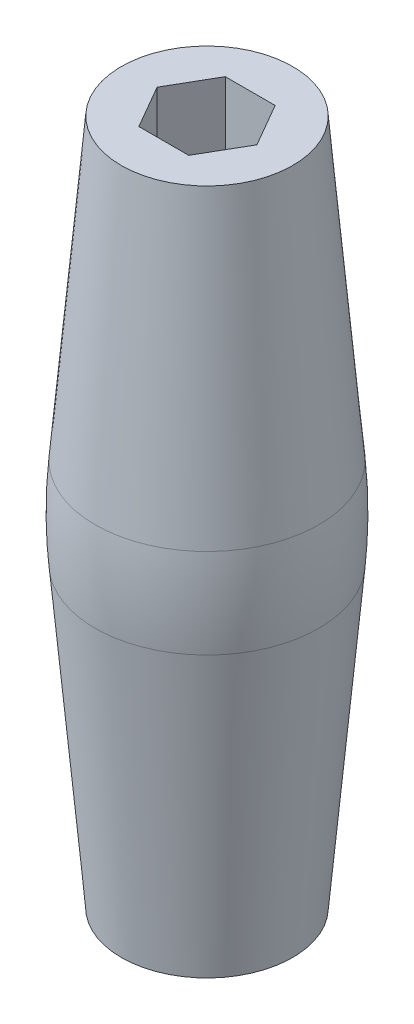
from build123d import *

# Parameters (mm, degrees)
SKETCH1_R           = 12.7
BOSS_EXTRUDE1_DEPTH = 101.6
SKETCH2_R           = 12.7
BOSS_EXTRUDE2_DEPTH = 50.8
BOSS_EXTRUDE2_DRAFT = 5
SKETCH3_R           = 12.7
BOSS_EXTRUDE3_DEPTH = 50.8
BOSS_EXTRUDE3_DRAFT = 5
CUT_EXTRUDE1_DEPTH  = 105.452968153
FILLET2_R           = 76.2


with BuildPart() as part:
    # Sketch1 → Boss-Extrude1 (new body)
    with BuildSketch(Plane(origin=(0, 0, 0), x_dir=(1, 0, 0), z_dir=(0, 1, 0))):
        with Locations(Location((0, 0, 0), (0, 0, 270))):
            Circle(SKETCH1_R)
    extrude(amount=BOSS_EXTRUDE1_DEPTH)


with BuildPart() as boss_extrude2_tool:
    # Sketch2 → Boss-Extrude2 (with draft: the straight prism first)
    with BuildSketch(Plane(origin=(0, 101.6, 0), x_dir=(1, 0, 0), z_dir=(0, 1, 0))):
        with Locations(Location((0, 0, 0), (0, 0, 270))):
            Circle(SKETCH2_R)
    extrude(amount=-BOSS_EXTRUDE2_DEPTH)
    # Boss-Extrude2: the draft: its side faces are tilted about the plane it starts from
    boss_extrude2_sides = [boss_extrude2_tool.faces().sort_by_distance(p)[0] for p in [
        (0, 76.2, -12.7),
    ]]
    draft(boss_extrude2_sides, Plane(origin=(0, 101.6, 0), x_dir=(1, 0, 0), z_dir=(0, 1, 0)), BOSS_EXTRUDE2_DRAFT)


with BuildPart() as part_1:
    add(part.part)

    # Boss-Extrude2: add boss_extrude2_tool
    add(boss_extrude2_tool.part)


with BuildPart() as boss_extrude3_tool:
    # Sketch3 → Boss-Extrude3 (with draft: the straight prism first)
    with BuildSketch(Plane(origin=(0, 0, 0), x_dir=(-1, 0, 0), z_dir=(0, -1, 0))):
        Circle(SKETCH3_R)
    extrude(amount=-BOSS_EXTRUDE3_DEPTH)
    # Boss-Extrude3: the draft: its side faces are tilted about the plane it starts from
    boss_extrude3_sides = [boss_extrude3_tool.faces().sort_by_distance(p)[0] for p in [
        (12.7, 25.4, 0),
    ]]
    draft(boss_extrude3_sides, Plane(origin=(0, 0, 0), x_dir=(-1, 0, 0), z_dir=(0, -1, 0)), BOSS_EXTRUDE3_DRAFT)


with BuildPart() as part_2:
    add(part_1.part)

    # Boss-Extrude3: add boss_extrude3_tool
    add(boss_extrude3_tool.part)

    # Sketch5 → Cut-Extrude1 (cut, through all)
    with BuildSketch(Plane(origin=(0, 0, 0), x_dir=(-1, 0, 0), z_dir=(0, -1, 0))):
        Polygon((-7.391007206, 0), (-3.695503603, -6.4008), (3.695503603, -6.4008), (7.391007206, 0), (3.695503603, 6.4008), (-3.695503603, 6.4008), align=None)
    extrude(amount=-CUT_EXTRUDE1_DEPTH, mode=Mode.SUBTRACT)

    # Fillet2
    fillet2_edges = [part_2.edges().sort_by_distance(p)[0] for p in [
        (12.122938546, 50.8, -12.122938546),
    ]]
    fillet(fillet2_edges, radius=FILLET2_R)


solid = part_2.part
